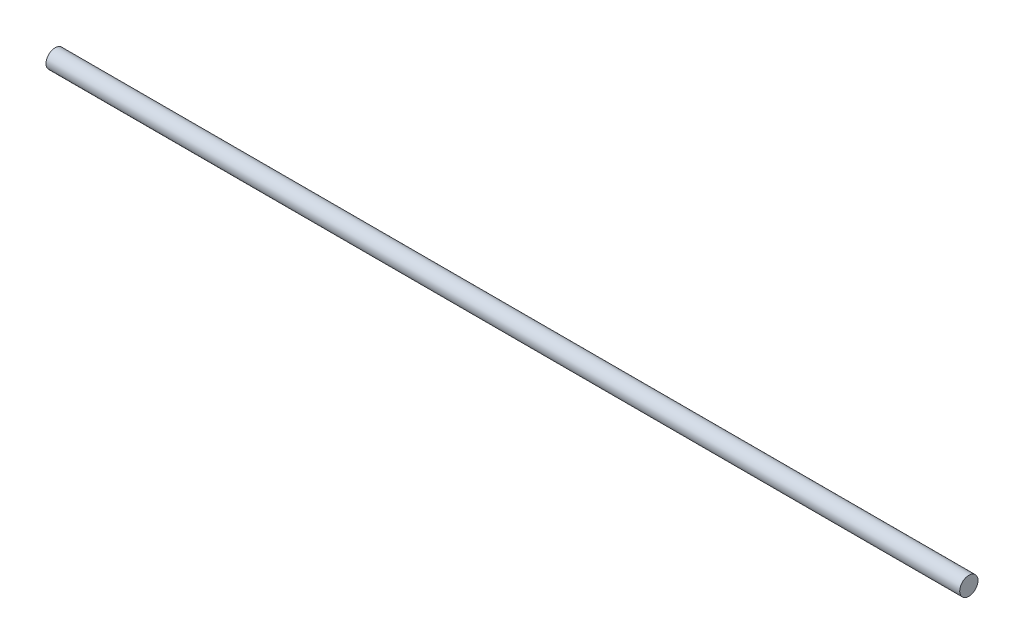
from build123d import *

# Parameters (mm, degrees)
SECTION_SKETCH_R     = 4
EXTRUDE_LENGTH_DEPTH = 400


with BuildPart() as part:
    # Section Sketch → Extrude Length (new body)
    with BuildSketch(Plane(origin=(0, 0, 0), x_dir=(0, 0, -1), z_dir=(1, 0, 0))):
        Circle(SECTION_SKETCH_R)
    extrude(amount=EXTRUDE_LENGTH_DEPTH)


solid = part.part
